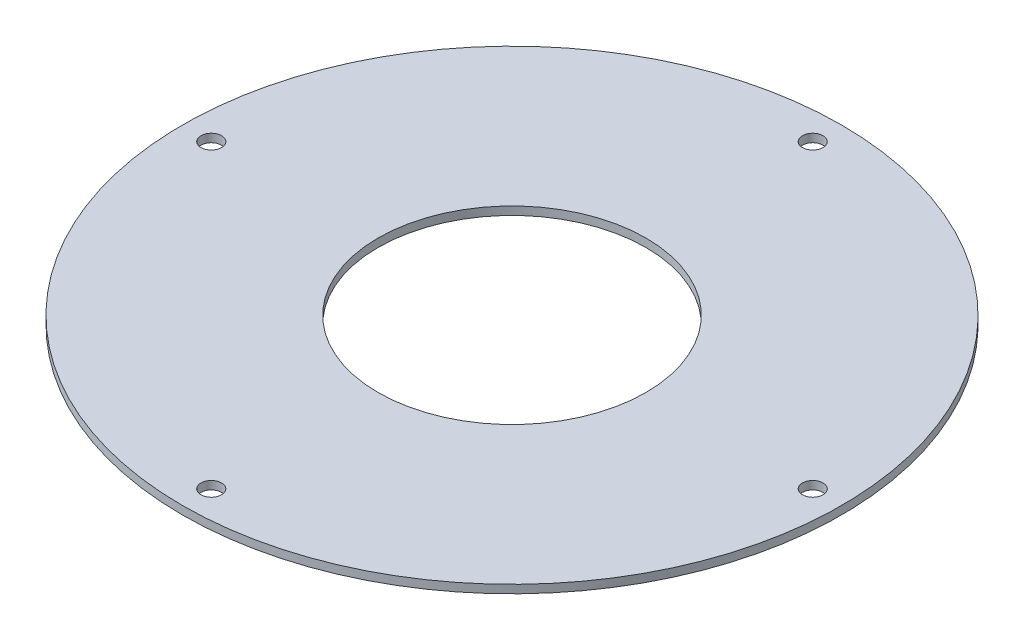
from build123d import *

# Parameters (mm, degrees)
SKETCH1_R           = 80
SKETCH1_R_2         = 32.5
BOSS_EXTRUDE1_DEPTH = 2
SKETCH2_R           = 2.5
CUT_EXTRUDE1_DEPTH  = 114.154761279


with BuildPart() as part:
    # Sketch1 → Boss-Extrude1 (new body)
    with BuildSketch(Plane(origin=(0, 0, 0), x_dir=(1, 0, 0), z_dir=(0, 1, 0))):
        with Locations(Location((0, 0, 0), (0, 0, 270))):
            Circle(SKETCH1_R)
        with Locations(Location((0, 0, 0), (0, 0, 270))):
            Circle(SKETCH1_R_2, mode=Mode.SUBTRACT)
    extrude(amount=BOSS_EXTRUDE1_DEPTH)

    # Sketch2 → Cut-Extrude1 (cut, through all)
    with BuildSketch(Plane(origin=(0, 2, 0), x_dir=(1, 0, 0), z_dir=(0, 1, 0))):
        with Locations(Location((0, 73, 0), (0, 0, 270))):
            Circle(SKETCH2_R)
        with Locations(Location((73, 0, 0), (0, 0, 270))):
            Circle(SKETCH2_R)
        with Locations(Location((0, -73, 0), (0, 0, 270))):
            Circle(SKETCH2_R)
        with Locations(Location((-73, 0, 0), (0, 0, 270))):
            Circle(SKETCH2_R)
    extrude(amount=-CUT_EXTRUDE1_DEPTH, mode=Mode.SUBTRACT)


solid = part.part
